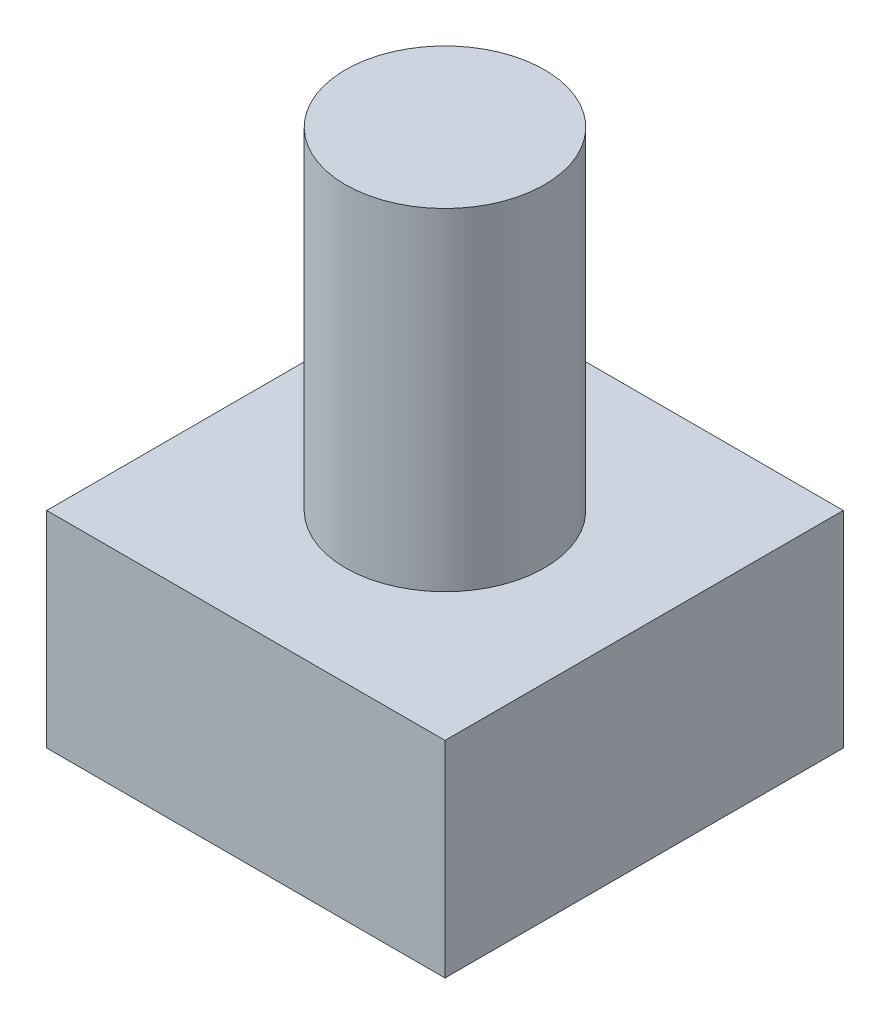
from build123d import *

# Parameters (mm, degrees)
SKETCH_1_W      = 6
SKETCH_1_H      = 6
EXTRUDE_1_DEPTH = 3.1
SKETCH_2_R      = 1.5
EXTRUDE_2_DEPTH = 5


with BuildPart() as part:
    # 草图1 → 拉伸1 (new body)
    with BuildSketch(Plane(origin=(0, 0, 0), x_dir=(1, 0, 0), z_dir=(0, 1, 0))):
        Rectangle(SKETCH_1_W, SKETCH_1_H)
    extrude(amount=EXTRUDE_1_DEPTH)

    # 草图2 → 拉伸2 (add)
    with BuildSketch(Plane(origin=(0, 3.1, 0), x_dir=(-1, 0, 0), z_dir=(0, 1, 0))):
        with Locations(Location((0, 0, 0), (0, 0, 90))):
            Circle(SKETCH_2_R)
    extrude(amount=EXTRUDE_2_DEPTH)


solid = part.part
